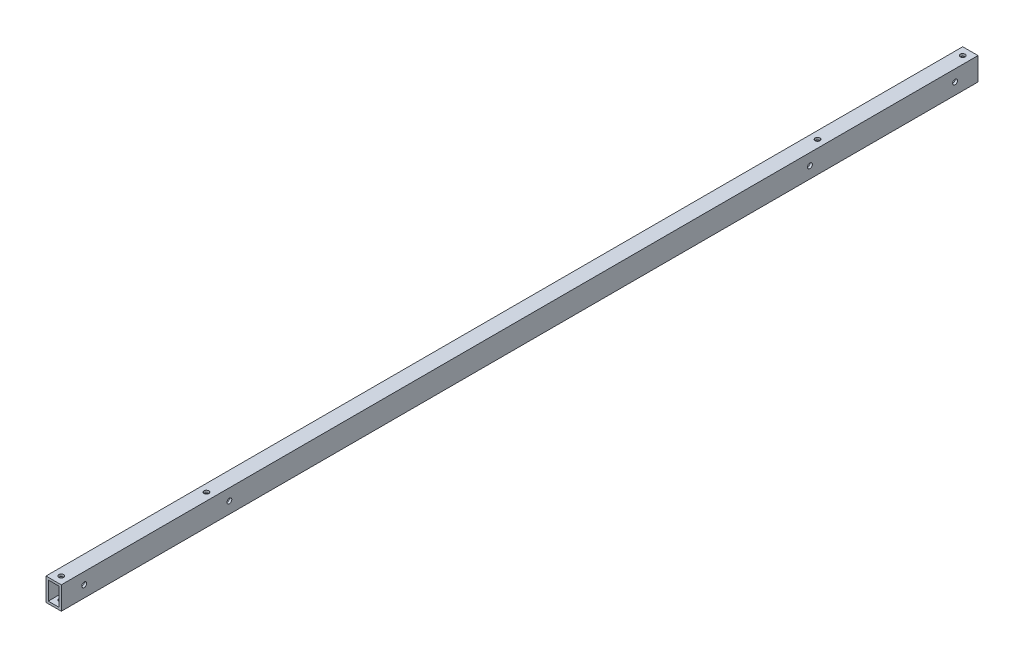
from build123d import *

# Parameters (mm, degrees)
SKETCH_1_W          = 10
SKETCH_1_H          = 15
SKETCH_1_W_2        = 7
SKETCH_1_H_2        = 12
EXTRUDE_1_DEPTH     = 600
SKETCH_2_R          = 1.6
CUT_EXTRUDE_1_DEPTH = 601.208297177
SKETCH_3_R          = 1.6
CUT_EXTRUDE_2_DEPTH = 601.130194208


with BuildPart() as part:
    # ｽｹｯﾁ1 → 押し出し-薄板1 (new body)
    with BuildSketch(Plane.XY):
        Rectangle(SKETCH_1_W, SKETCH_1_H)
        Rectangle(SKETCH_1_W_2, SKETCH_1_H_2, mode=Mode.SUBTRACT)
    extrude(amount=EXTRUDE_1_DEPTH)

    # ｽｹｯﾁ2 → ｶｯﾄ - 押し出し1 (cut, through all)
    with BuildSketch(Plane(origin=(0, 7.5, 0), x_dir=(1, 0, 0), z_dir=(0, 1, 0))):
        with Locations(Location((0, -595, 0), (0, 0, 270))):
            Circle(SKETCH_2_R)
        with Locations(Location((0, -5, 0), (0, 0, 270))):
            Circle(SKETCH_2_R)
        with Locations(Location((0, -500, 0), (0, 0, 270))):
            Circle(SKETCH_2_R)
        with Locations(Location((0, -100, 0), (0, 0, 270))):
            Circle(SKETCH_2_R)
    extrude(amount=-CUT_EXTRUDE_1_DEPTH, mode=Mode.SUBTRACT)

    # ｽｹｯﾁ3 → ｶｯﾄ - 押し出し2 (cut, through all)
    with BuildSketch(Plane(origin=(5, 0, 0), x_dir=(0, 0, -1), z_dir=(1, 0, 0))):
        with Locations((-585, 0)):
            Circle(SKETCH_3_R)
        with Locations((-15, 0)):
            Circle(SKETCH_3_R)
        with Locations((-490, 0)):
            Circle(SKETCH_3_R)
        with Locations((-110, 0)):
            Circle(SKETCH_3_R)
    extrude(amount=-CUT_EXTRUDE_2_DEPTH, mode=Mode.SUBTRACT)


solid = part.part
